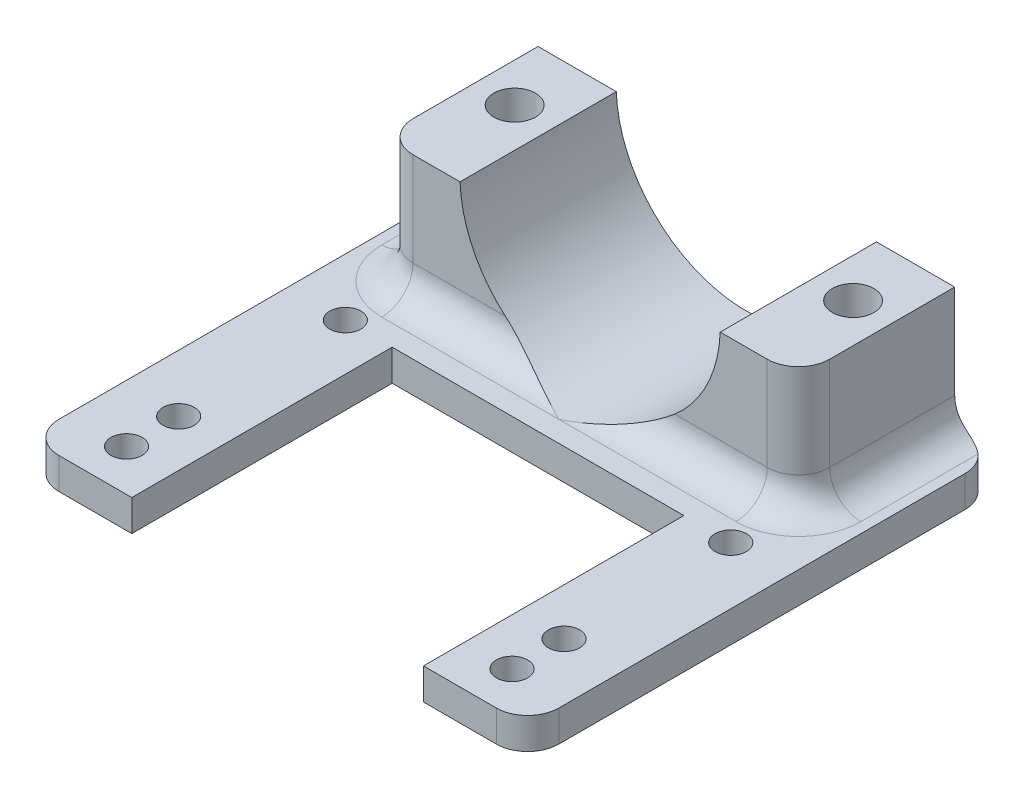
from build123d import *

# Parameters (mm, degrees)
SKETCH1_R           = 1.5
BOSS_EXTRUDE1_DEPTH = 3
SKETCH4_W           = 40
SKETCH4_H           = 15
BOSS_EXTRUDE2_DEPTH = 15
FILLET5_R           = 3
SKETCH5_R           = 12.5
CUT_EXTRUDE1_DEPTH  = 54.160135485
SKETCH6_R           = 2
CUT_EXTRUDE2_DEPTH  = 5


with BuildPart() as part:
    # Sketch1 → Boss-Extrude1 (new body)
    with BuildSketch(Plane(origin=(0, 0, 0), x_dir=(1, 0, 0), z_dir=(0, 1, 0))):
        with BuildLine():
            Line((21, 22.5), (-21, 22.5))
            ThreePointArc((-21, 22.5), (-23.121320344, 21.621320344), (-24, 19.5))
            Line((-24, 19.5), (-24, -19.5))
            ThreePointArc((-24, -19.5), (-23.121320344, -21.621320344), (-21, -22.5))
            Line((-21, -22.5), (-14, -22.5))
            Line((-14, -22.5), (-14, 2.5))
            Line((-14, 2.5), (14, 2.5))
            Line((14, 2.5), (14, -22.5))
            Line((14, -22.5), (21, -22.5))
            ThreePointArc((21, -22.5), (23.121320344, -21.621320344), (24, -19.5))
            Line((24, -19.5), (24, 19.5))
            ThreePointArc((24, 19.5), (23.121320344, 21.621320344), (21, 22.5))
        make_face()
        with Locations(Location((-18.5, -18.5, 0), (0, 0, 270))):
            Circle(SKETCH1_R, mode=Mode.SUBTRACT)
        with Locations(Location((-18.5, -13.5, 0), (0, 0, 270))):
            Circle(SKETCH1_R, mode=Mode.SUBTRACT)
        with Locations(Location((18.5, -18.5, 0), (0, 0, 270))):
            Circle(SKETCH1_R, mode=Mode.SUBTRACT)
        with Locations(Location((18.5, -13.5, 0), (0, 0, 270))):
            Circle(SKETCH1_R, mode=Mode.SUBTRACT)
        with Locations(Location((-18.5, 2.5, 0), (0, 0, 270))):
            Circle(SKETCH1_R, mode=Mode.SUBTRACT)
        with Locations(Location((18.5, 2.5, 0), (0, 0, 270))):
            Circle(SKETCH1_R, mode=Mode.SUBTRACT)
    extrude(amount=BOSS_EXTRUDE1_DEPTH)

    # Sketch4 → Boss-Extrude2 (add)
    with BuildSketch(Plane(origin=(0, 0, -22.5), x_dir=(-1, 0, 0), z_dir=(0, 0, -1))):
        with Locations((0, 7.5)):
            Rectangle(SKETCH4_W, SKETCH4_H)
    extrude(amount=-BOSS_EXTRUDE2_DEPTH)

    # Fillet5
    fillet5_edges = [part.edges().sort_by_distance(p)[0] for p in [
        (20, 3, -15),
        (-20, 3, -15),
        (0, 3, -7.5),
        (20, 9, -7.5),
        (-20, 9, -7.5),
    ]]
    fillet(fillet5_edges, radius=FILLET5_R)

    # Sketch5 → Cut-Extrude1 (cut, through all)
    with BuildSketch(Plane(origin=(0, 0, -22.5), x_dir=(-1, 0, 0), z_dir=(0, 0, -1))):
        with Locations((0, 15.5)):
            Circle(SKETCH5_R)
    extrude(amount=-CUT_EXTRUDE1_DEPTH, mode=Mode.SUBTRACT)

    # Sketch6 → Cut-Extrude2 (cut)
    with BuildSketch(Plane(origin=(0, 15, 0), x_dir=(1, 0, 0), z_dir=(0, 1, 0))):
        with Locations(Location((-16.244997998, 16.5, 0), (0, 0, 270))):
            Circle(SKETCH6_R)
        with Locations(Location((16.244997998, 16.5, 0), (0, 0, 90))):
            Circle(SKETCH6_R)
    extrude(amount=-CUT_EXTRUDE2_DEPTH, mode=Mode.SUBTRACT)


solid = part.part
